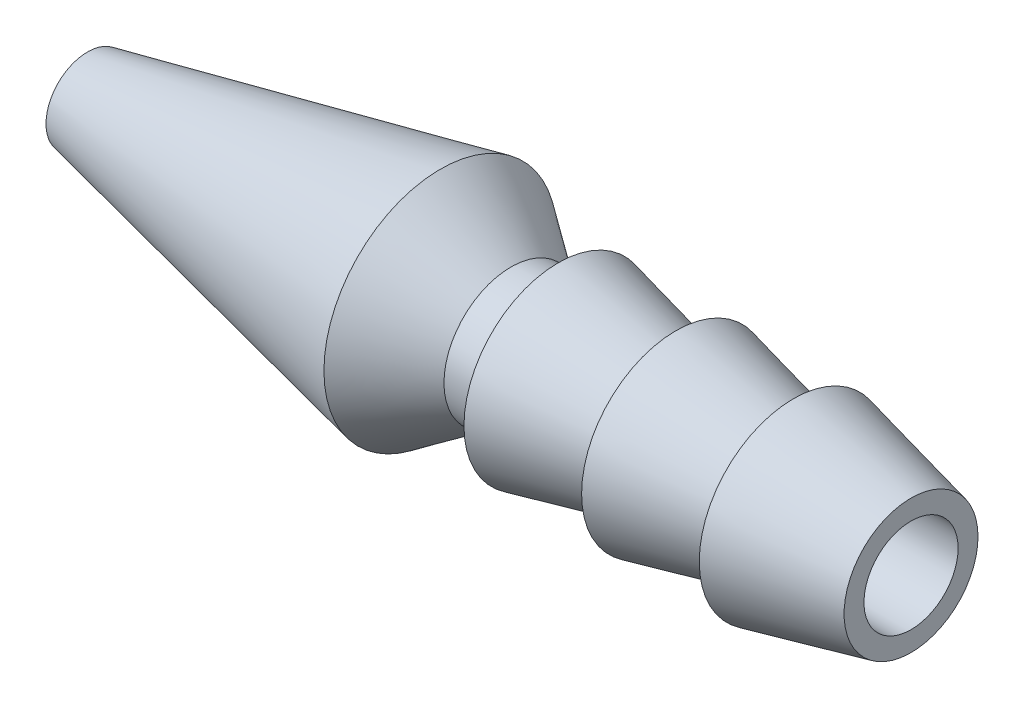
from build123d import *

# Parameters (mm, degrees)
SKETCH1_R           = 4
BOSS_EXTRUDE1_DEPTH = 5
BOSS_EXTRUDE1_TAPER = 13
SKETCH2_R           = 4
BOSS_EXTRUDE2_DEPTH = 5
BOSS_EXTRUDE2_TAPER = 13
SKETCH3_R           = 4
BOSS_EXTRUDE3_DEPTH = 5
BOSS_EXTRUDE3_TAPER = 13
SKETCH4_R           = 2.85
BOSS_EXTRUDE4_DEPTH = 2
SKETCH5_R           = 2.85
BOSS_EXTRUDE5_DEPTH = 3
BOSS_EXTRUDE5_DRAFT = -35
SKETCH6_R           = 4.950622615
BOSS_EXTRUDE6_DEPTH = 15
BOSS_EXTRUDE6_TAPER = 12
SKETCH9_R           = 2
CUT_EXTRUDE1_DEPTH  = 20
SKETCH11_R          = 1.25
CUT_EXTRUDE5_DEPTH  = 15
CUT_EXTRUDE5_DRAFT  = 2.8


with BuildPart() as part:
    # Sketch1 → Boss-Extrude1 (new body)
    with BuildSketch(Plane(origin=(0, 0, 0), x_dir=(0, 0, -1), z_dir=(1, 0, 0))):
        Circle(SKETCH1_R)
    extrude(amount=BOSS_EXTRUDE1_DEPTH, taper=BOSS_EXTRUDE1_TAPER)

    # Sketch2 → Boss-Extrude2 (add)
    with BuildSketch(Plane(origin=(5, 0, 0), x_dir=(0, 0, -1), z_dir=(1, 0, 0))):
        Circle(SKETCH2_R)
    extrude(amount=BOSS_EXTRUDE2_DEPTH, taper=BOSS_EXTRUDE2_TAPER)

    # Sketch3 → Boss-Extrude3 (add)
    with BuildSketch(Plane(origin=(10, 0, 0), x_dir=(0, 0, -1), z_dir=(1, 0, 0))):
        Circle(SKETCH3_R)
    extrude(amount=BOSS_EXTRUDE3_DEPTH, taper=BOSS_EXTRUDE3_TAPER)

    # Sketch4 → Boss-Extrude4 (add)
    with BuildSketch(Plane.ZY):
        Circle(SKETCH4_R)
    extrude(amount=BOSS_EXTRUDE4_DEPTH)


with BuildPart() as boss_extrude5_tool:
    # Sketch5 → Boss-Extrude5 (with draft: the straight prism first)
    with BuildSketch(Plane.ZY.offset(2)):
        Circle(SKETCH5_R)
    extrude(amount=BOSS_EXTRUDE5_DEPTH)
    # Boss-Extrude5: the draft: its side faces are tilted about the plane it starts from
    boss_extrude5_sides = [boss_extrude5_tool.faces().sort_by_distance(p)[0] for p in [
        (-3.5, 0, -2.85),
    ]]
    draft(boss_extrude5_sides, Plane.ZY.offset(2), BOSS_EXTRUDE5_DRAFT)


with BuildPart() as part_1:
    add(part.part)

    # Boss-Extrude5: add boss_extrude5_tool
    add(boss_extrude5_tool.part)

    # Sketch6 → Boss-Extrude6 (add)
    with BuildSketch(Plane.ZY.offset(5)):
        Circle(SKETCH6_R)
    extrude(amount=BOSS_EXTRUDE6_DEPTH, taper=BOSS_EXTRUDE6_TAPER)

    # Sketch9 → Cut-Extrude1 (cut)
    with BuildSketch(Plane(origin=(15, 0, 0), x_dir=(0, 0, -1), z_dir=(1, 0, 0))):
        Circle(SKETCH9_R)
    extrude(amount=-CUT_EXTRUDE1_DEPTH, mode=Mode.SUBTRACT)


with BuildPart() as cut_extrude5_tool:
    # Sketch11 → Cut-Extrude5 (with draft: the straight prism first)
    with BuildSketch(Plane.ZY.offset(20)):
        Circle(SKETCH11_R)
    extrude(amount=-CUT_EXTRUDE5_DEPTH)
    # Cut-Extrude5: the draft: its side faces are tilted about the plane it starts from
    cut_extrude5_sides = [cut_extrude5_tool.faces().sort_by_distance(p)[0] for p in [
        (-12.5, 0, -1.25),
    ]]
    draft(cut_extrude5_sides, Plane.ZY.offset(20), CUT_EXTRUDE5_DRAFT)


with BuildPart() as part_2:
    add(part_1.part)

    # Cut-Extrude5: cut by cut_extrude5_tool
    add(cut_extrude5_tool.part, mode=Mode.SUBTRACT)


solid = part_2.part
